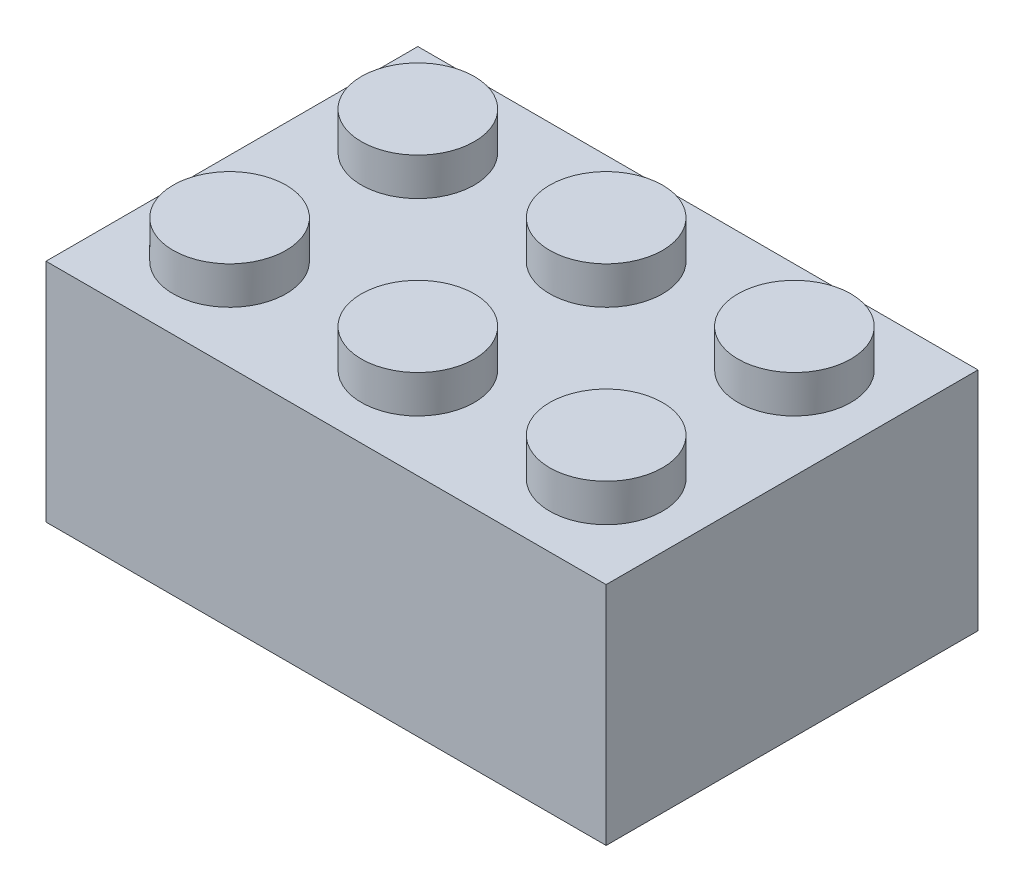
from build123d import *

# Parameters (mm, degrees)
SKETCH1_W            = 23.8
SKETCH1_H            = 9.6
BOSS_EXTRUDE1_DEPTH  = 15.8
SKETCH2_R            = 2.4
BOSS_EXTRUDE2_DEPTH  = 1.6
LPATTERN1_COUNT      = 3
LPATTERN1_PITCH      = 8
LPATTERN1_COUNT_DIR2 = 2
LPATTERN1_PITCH_DIR2 = 8
SHELL1_T             = -1.2
SKETCH3_R            = 3.25
SKETCH3_R_2          = 2.4
BOSS_EXTRUDE3_DEPTH  = 8.2
LPATTERN2_COUNT      = 2
LPATTERN2_PITCH      = 8


with BuildPart() as part:
    # Sketch1 → Boss-Extrude1 (new body)
    with BuildSketch(Plane.XY):
        with Locations((11.9, 4.8)):
            Rectangle(SKETCH1_W, SKETCH1_H)
    extrude(amount=-BOSS_EXTRUDE1_DEPTH)

    # Sketch2 → Boss-Extrude2 (add)
    with BuildSketch(Plane(origin=(0, 9.6, 0), x_dir=(1, 0, 0), z_dir=(0, 1, 0))):
        with Locations(Location((3.9, 3.9, 0), (0, 0, 90))):
            Circle(SKETCH2_R)
    boss_extrude2 = extrude(amount=BOSS_EXTRUDE2_DEPTH)

    # LPattern1: Boss-Extrude2 3 × 2
    with Locations(*[(i * LPATTERN1_PITCH, 0, -j * LPATTERN1_PITCH_DIR2) for i in range(LPATTERN1_COUNT) for j in range(LPATTERN1_COUNT_DIR2) if (i, j) != (0, 0)]):
        add(boss_extrude2)

    # Shell1
    shell1_openings = [part.faces().sort_by_distance(p)[0] for p in [
        (11.9, 0, -7.9),
    ]]
    offset(amount=SHELL1_T, openings=shell1_openings, kind=Kind.INTERSECTION)

    # Sketch3 → Boss-Extrude3 (add)
    with BuildSketch(Plane.XZ.offset(-8.4)):
        with Locations(Location((7.9, -7.9, 0), (0, 0, 270))):
            Circle(SKETCH3_R)
        with Locations(Location((7.9, -7.9, 0), (0, 0, 270))):
            Circle(SKETCH3_R_2, mode=Mode.SUBTRACT)
    boss_extrude3 = extrude(amount=BOSS_EXTRUDE3_DEPTH)

    # LPattern2: Boss-Extrude3 ×2
    with Locations(*[(i * LPATTERN2_PITCH, 0, 0) for i in range(1, LPATTERN2_COUNT)]):
        add(boss_extrude3)


solid = part.part
